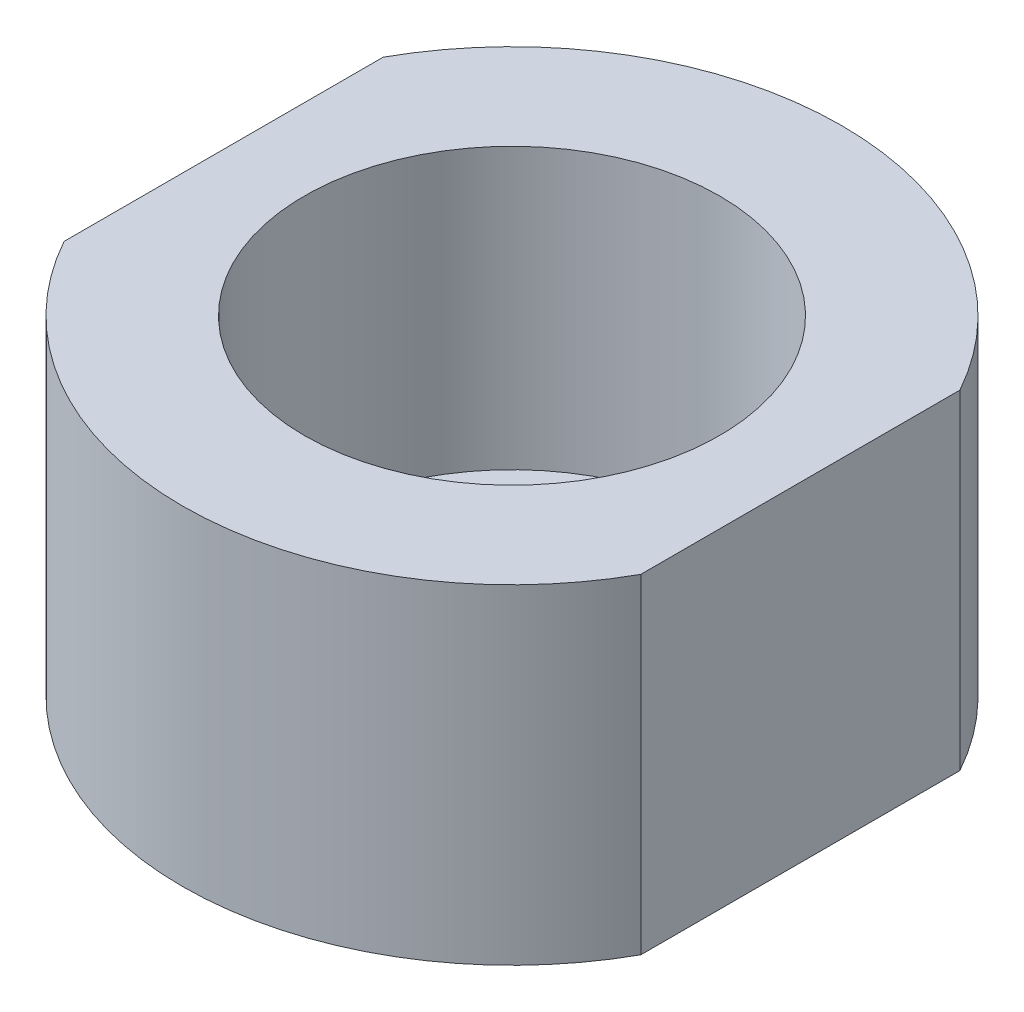
from build123d import *

# Parameters (mm, degrees)
SKETCH1_R                           = 25.4
BOSS_EXTRUDE1_DEPTH                 = 25.4
SKETCH2_R                           = 16
CUT_EXTRUDE1_DEPTH                  = 21.59
CUT_EXTRUDE2_REACH                  = 45.994
CUT_EXTRUDE2_END_RADIUS             = 25.4
SKETCH3_W                           = 3.175
SKETCH3_H                           = 16.51
CUT_EXTRUDE2_DIRECTION_2_REACH      = 45.994
CUT_EXTRUDE2_DIRECTION_2_END_RADIUS = 25.4
CUT_EXTRUDE3_REACH                  = 43.91
SKETCH4_R                           = 1
CUT_EXTRUDE4_REACH                  = 41.534


with BuildPart() as part:
    # Sketch1 → Boss-Extrude1 (new body)
    with BuildSketch(Plane(origin=(0, 0, 0), x_dir=(1, 0, 0), z_dir=(0, 1, 0))):
        with Locations(Location((0, 0, 0), (0, 0, 270))):
            Circle(SKETCH1_R)
    extrude(amount=BOSS_EXTRUDE1_DEPTH)

    # Sketch2 → Cut-Extrude1 (cut)
    with BuildSketch(Plane(origin=(0, 25.4, 0), x_dir=(1, 0, 0), z_dir=(0, 1, 0))):
        with Locations(Location((0, 0, 0), (0, 0, 270))):
            Circle(SKETCH2_R)
    extrude(amount=-CUT_EXTRUDE1_DEPTH, mode=Mode.SUBTRACT)

    # Cut-Extrude2: up to this cylinder (the profile starts inside it)
    cut_extrude2_end = Plane(origin=(0, 17.145, 0), z_dir=(0, -1, 0)) * Cylinder(CUT_EXTRUDE2_END_RADIUS, 143.788, mode=Mode.PRIVATE)
    # Sketch3 → Cut-Extrude2 (cut, up to the surface)
    with BuildSketch(Plane.XY, mode=Mode.PRIVATE) as cut_extrude2_sk1:
        with Locations((23.8125, 17.145)):
            Rectangle(SKETCH3_W, SKETCH3_H)
    cut_extrude2_tool1 = extrude(cut_extrude2_sk1.sketch, amount=-CUT_EXTRUDE2_REACH, mode=Mode.PRIVATE) & cut_extrude2_end
    add(cut_extrude2_tool1.solids().sort_by_distance((23.8125, 17.145, 0))[0], mode=Mode.SUBTRACT)
    # Sketch3 → Cut-Extrude2 (cut, up to the surface)
    with BuildSketch(Plane.XY, mode=Mode.PRIVATE) as cut_extrude2_sk2:
        with Locations((-23.8125, 17.145)):
            Rectangle(SKETCH3_W, SKETCH3_H)
    cut_extrude2_tool2 = extrude(cut_extrude2_sk2.sketch, amount=-CUT_EXTRUDE2_REACH, mode=Mode.PRIVATE) & cut_extrude2_end
    add(cut_extrude2_tool2.solids().sort_by_distance((-23.8125, 17.145, 0))[0], mode=Mode.SUBTRACT)

    # Cut-Extrude2 direction 2: up to this cylinder (the profile starts inside it)
    cut_extrude2_direction_2_end = Plane(origin=(0, 17.145, 0), z_dir=(0, -1, 0)) * Cylinder(CUT_EXTRUDE2_DIRECTION_2_END_RADIUS, 143.788, mode=Mode.PRIVATE)
    # Sketch3 → Cut-Extrude2 direction 2 (cut, up to the surface)
    with BuildSketch(Plane.XY, mode=Mode.PRIVATE) as cut_extrude2_direction_2_sk1:
        with Locations((23.8125, 17.145)):
            Rectangle(SKETCH3_W, SKETCH3_H)
    cut_extrude2_direction_2_tool1 = extrude(cut_extrude2_direction_2_sk1.sketch, amount=CUT_EXTRUDE2_DIRECTION_2_REACH, mode=Mode.PRIVATE) & cut_extrude2_direction_2_end
    add(cut_extrude2_direction_2_tool1.solids().sort_by_distance((23.8125, 17.145, 0))[0], mode=Mode.SUBTRACT)
    # Sketch3 → Cut-Extrude2 direction 2 (cut, up to the surface)
    with BuildSketch(Plane.XY, mode=Mode.PRIVATE) as cut_extrude2_direction_2_sk2:
        with Locations((-23.8125, 17.145)):
            Rectangle(SKETCH3_W, SKETCH3_H)
    cut_extrude2_direction_2_tool2 = extrude(cut_extrude2_direction_2_sk2.sketch, amount=CUT_EXTRUDE2_DIRECTION_2_REACH, mode=Mode.PRIVATE) & cut_extrude2_direction_2_end
    add(cut_extrude2_direction_2_tool2.solids().sort_by_distance((-23.8125, 17.145, 0))[0], mode=Mode.SUBTRACT)

    # Sketch4 → Cut-Extrude3 (cut, up to next)
    with BuildSketch(Plane(origin=(0, 3.81, 0), x_dir=(1, 0, 0), z_dir=(0, 1, 0)), mode=Mode.PRIVATE) as cut_extrude3_sk1:
        with Locations(Location((0, 8.89, 0), (0, 0, 270))):
            Circle(SKETCH4_R)
    cut_extrude3_tool1 = extrude(cut_extrude3_sk1.sketch, amount=-CUT_EXTRUDE3_REACH, mode=Mode.PRIVATE) & part.part
    # Sketch4 → Cut-Extrude3 (cut, up to next)
    with BuildSketch(Plane(origin=(0, 3.81, 0), x_dir=(1, 0, 0), z_dir=(0, 1, 0)), mode=Mode.PRIVATE) as cut_extrude3_sk2:
        with Locations(Location((7.69896584, -4.445, 0), (0, 0, 270))):
            Circle(SKETCH4_R)
    cut_extrude3_tool2 = extrude(cut_extrude3_sk2.sketch, amount=-CUT_EXTRUDE3_REACH, mode=Mode.PRIVATE) & part.part
    # Sketch4 → Cut-Extrude3 (cut, up to next)
    with BuildSketch(Plane(origin=(0, 3.81, 0), x_dir=(1, 0, 0), z_dir=(0, 1, 0)), mode=Mode.PRIVATE) as cut_extrude3_sk3:
        with Locations(Location((-7.69896584, -4.445, 0), (0, 0, 270))):
            Circle(SKETCH4_R)
    cut_extrude3_tool3 = extrude(cut_extrude3_sk3.sketch, amount=-CUT_EXTRUDE3_REACH, mode=Mode.PRIVATE) & part.part
    add(cut_extrude3_tool1.solids().sort_by_distance((0, 3.81, -8.89))[0], mode=Mode.SUBTRACT)
    add(cut_extrude3_tool2.solids().sort_by_distance((7.698966, 3.81, 4.445))[0], mode=Mode.SUBTRACT)
    add(cut_extrude3_tool3.solids().sort_by_distance((-7.698966, 3.81, 4.445))[0], mode=Mode.SUBTRACT)

    # Sketch5 → Cut-Extrude4 (cut, up to next)
    with BuildSketch(Plane(origin=(0, 8.89, 0), x_dir=(1, 0, 0), z_dir=(0, 1, 0)), mode=Mode.PRIVATE) as cut_extrude4_sk1:
        with BuildLine():
            Line((22.225, 12.296722124), (22.225, -12.296722124))
            ThreePointArc((22.225, -12.296722124), (25.4, 0), (22.225, 12.296722124))
        make_face()
    cut_extrude4_tool1 = extrude(cut_extrude4_sk1.sketch, amount=-CUT_EXTRUDE4_REACH, mode=Mode.PRIVATE) & part.part
    # Sketch5 → Cut-Extrude4 (cut, up to next)
    with BuildSketch(Plane(origin=(0, 8.89, 0), x_dir=(1, 0, 0), z_dir=(0, 1, 0)), mode=Mode.PRIVATE) as cut_extrude4_sk2:
        with BuildLine():
            Line((-22.225, -12.296722124), (-22.225, 12.296722124))
            ThreePointArc((-22.225, 12.296722124), (-25.4, 0), (-22.225, -12.296722124))
        make_face()
    cut_extrude4_tool2 = extrude(cut_extrude4_sk2.sketch, amount=-CUT_EXTRUDE4_REACH, mode=Mode.PRIVATE) & part.part
    add(cut_extrude4_tool1.solids().sort_by_distance((23.502059, 8.89, 0))[0], mode=Mode.SUBTRACT)
    add(cut_extrude4_tool2.solids().sort_by_distance((-23.502059, 8.89, 0))[0], mode=Mode.SUBTRACT)


solid = part.part
